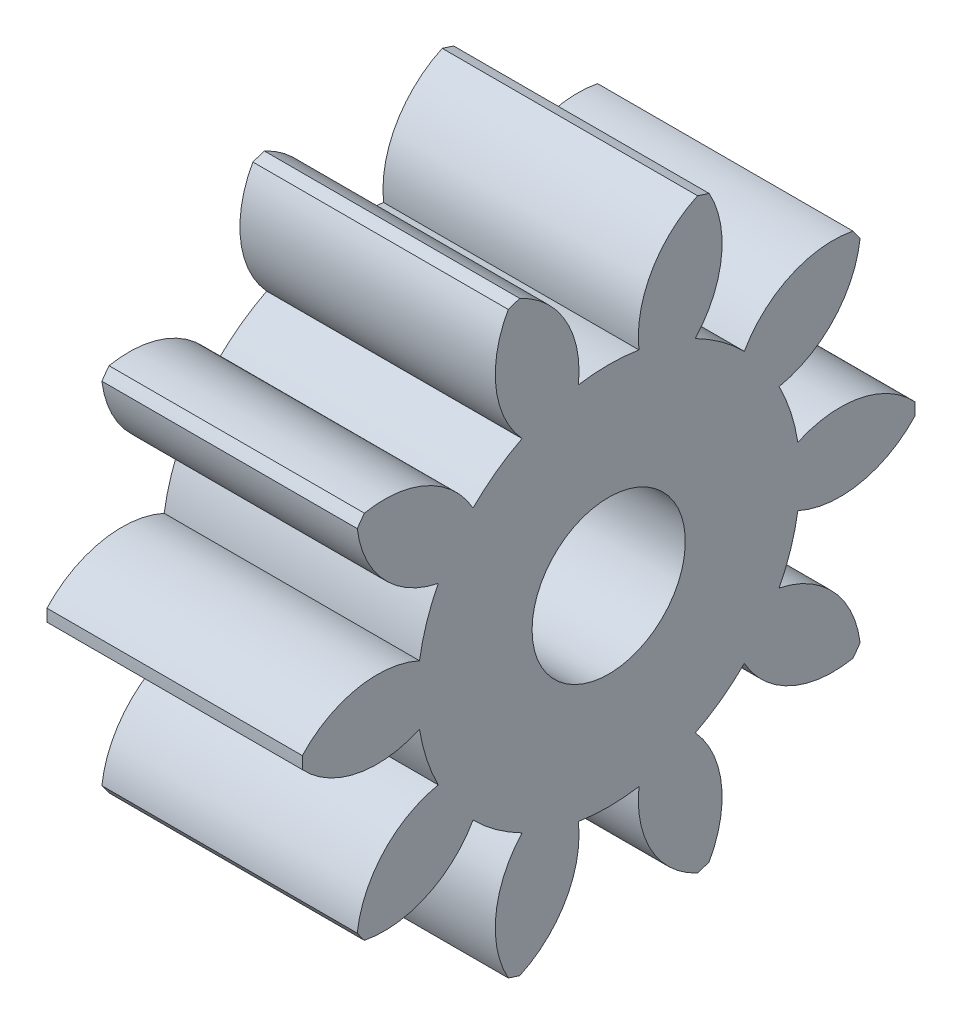
from build123d import *

# Parameters (mm, degrees)
BASPROSKE_W     = 5
BASPROSKE_H     = 6
TOOTHCUT_DEPTH  = 10.848857802
TEETHCUTS_COUNT = 10
TEETHCUTS_ANGLE = 324
BORSKE_R        = 1.5
BORE_DEPTH      = 50.0000508


with BuildPart() as part:
    # BasProSke → Base-Revolve (revolve)
    with BuildSketch(Plane(origin=(0, 0, 0), x_dir=(1, 0, 0), z_dir=(0, 1, 0)), mode=Mode.PRIVATE) as base_revolve_sk:
        with Locations((2.5, 3)):
            Rectangle(BASPROSKE_W, BASPROSKE_H)
    revolve(base_revolve_sk.sketch.rotate(Axis((-10, 0, 0), (1, 0, 0)), 180), axis=Axis((-10, 0, 0), (1, 0, 0)))

    # TooCutSke → ToothCut (cut, through all)
    with BuildSketch(Plane(origin=(0, 0, 0), x_dir=(0, 0, -1), z_dir=(1, 0, 0))):
        with BuildLine():
            ThreePointArc((0.59278292, 3.701838653), (0, 3.749), (-0.59278292, 3.701838653))
            ThreePointArc((-0.59278292, 3.701838653), (-0.846593509, 4.924114224), (-1.775771316, 5.757784417))
            ThreePointArc((-1.775771316, 5.757784417), (0, 6.0254), (1.775771316, 5.757784417))
            ThreePointArc((1.775771316, 5.757784417), (0.846593509, 4.924114224), (0.59278292, 3.701838653))
        make_face()
    toothcut = extrude(amount=TOOTHCUT_DEPTH, mode=Mode.SUBTRACT)

    # TeethCuts: ToothCut ×10 about axis
    teethcuts_axis = Axis((-10, 0, 0), (1, 0, 0))
    for i in range(1, TEETHCUTS_COUNT):
        add(toothcut.rotate(teethcuts_axis, i * TEETHCUTS_ANGLE / (TEETHCUTS_COUNT - 1)), mode=Mode.SUBTRACT)

    # BorSke → Bore (cut, symmetric)
    with BuildSketch(Plane(origin=(0, 0, 0), x_dir=(0, 0, -1), z_dir=(1, 0, 0))):
        with Locations(Location((0, 0, 0), (0, 0, 180))):
            Circle(BORSKE_R)
    extrude(amount=BORE_DEPTH, both=True, mode=Mode.SUBTRACT)


solid = part.part
